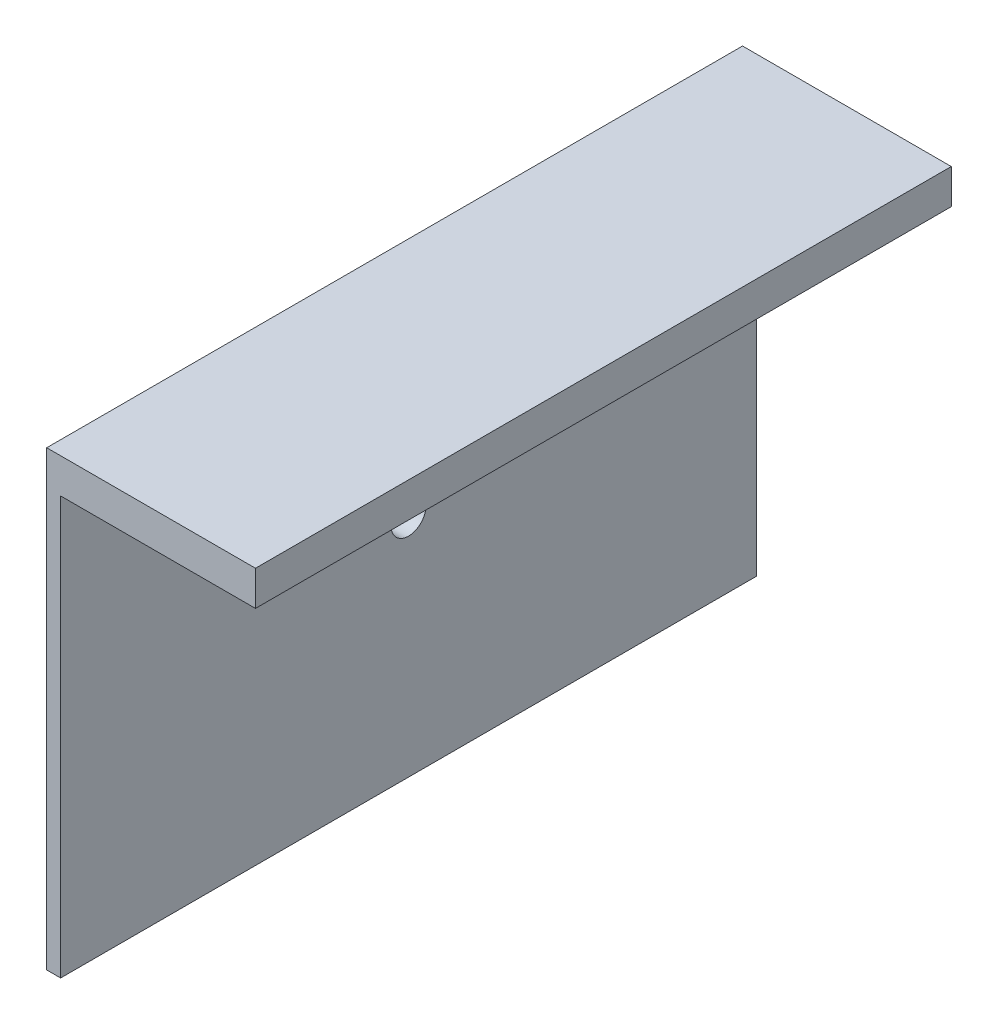
from build123d import *

# Parameters (mm, degrees)
SKETCH1_W           = 100
SKETCH1_H           = 65
SKETCH1_R           = 2.5
BOSS_EXTRUDE1_DEPTH = 2
SKETCH2_W           = 100
SKETCH2_H           = 5
BOSS_EXTRUDE2_DEPTH = 28


with BuildPart() as part:
    # Sketch1 → Boss-Extrude1 (new body)
    with BuildSketch(Plane(origin=(0, 0, 0), x_dir=(0, 0, -1), z_dir=(1, 0, 0))):
        Rectangle(SKETCH1_W, SKETCH1_H)
        Circle(SKETCH1_R, mode=Mode.SUBTRACT)
    extrude(amount=BOSS_EXTRUDE1_DEPTH)

    # Sketch2 → Boss-Extrude2 (add)
    with BuildSketch(Plane(origin=(2, 0, 0), x_dir=(0, 0, -1), z_dir=(1, 0, 0))):
        with Locations((0, 30)):
            Rectangle(SKETCH2_W, SKETCH2_H)
    extrude(amount=BOSS_EXTRUDE2_DEPTH)


solid = part.part
